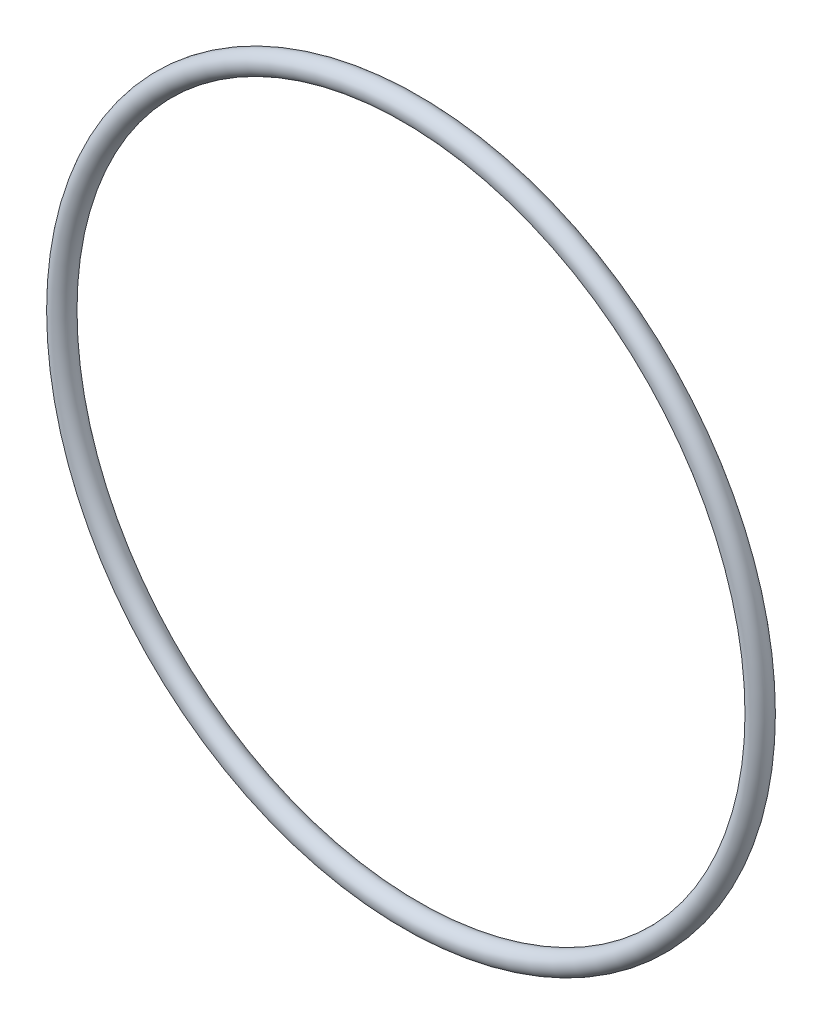
from build123d import *

# Parameters (mm, degrees)
SKETCH1_R = 1.5


with BuildPart() as part:
    # Sketch1 → Revolve1 (revolve)
    with BuildSketch(Plane(origin=(0, 0, 0), x_dir=(0, 0, -1), z_dir=(1, 0, 0)), mode=Mode.PRIVATE) as revolve1_sk:
        with Locations((0, 48.7)):
            Circle(SKETCH1_R)
    revolve(revolve1_sk.sketch.rotate(Axis((0, 0, 21.784086022), (0, 0, -1)), 90), axis=Axis((0, 0, 21.784086022), (0, 0, -1)))


solid = part.part
